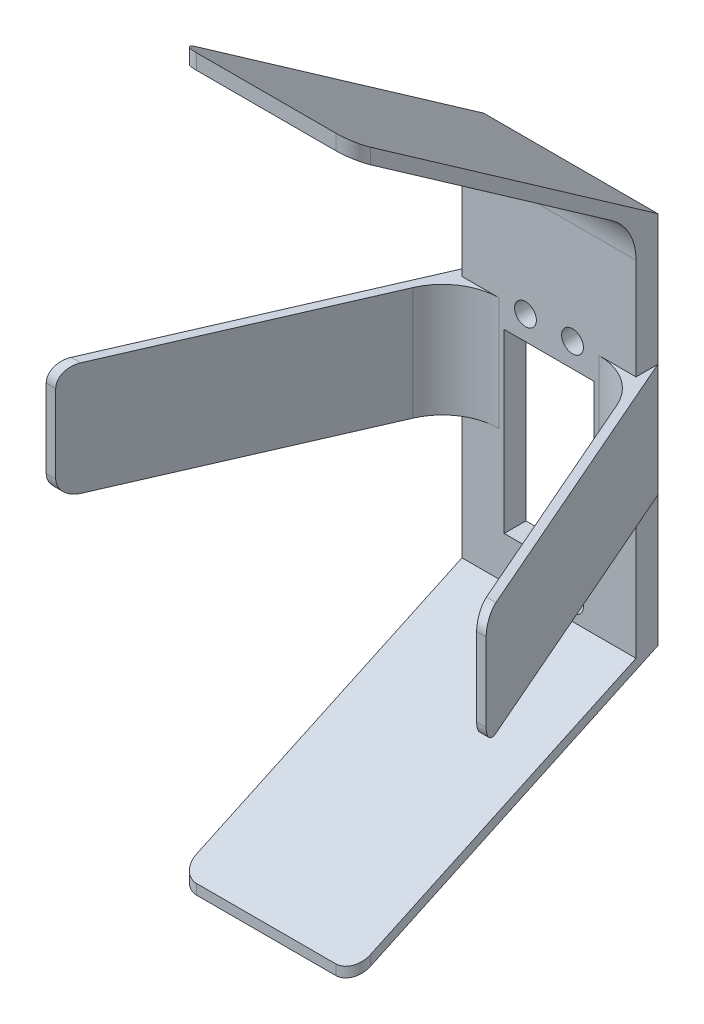
from build123d import *

# Parameters (mm, degrees)
ESQUISSE1_W             = 40
ESQUISSE1_H             = 60
ESQUISSE1_W_2           = 20.6
ESQUISSE1_H_2           = 40.6
BOSS_EXTRU_1_DEPTH      = 5
ESQUISSE2_W             = 40
ESQUISSE2_H             = 5
BOSS_EXTRU_2_DEPTH      = 26
BOSS_EXTRU_5_DEPTH      = 40
BOSS_EXTRU_6_DEPTH      = 26
CONG_1_R                = 13
CONG_2_R                = 4
ENL_V_MAT_EXTRU_1_REACH = 141.98
ESQUISSE6_R             = 2.5


with BuildPart() as part:
    # Esquisse1 → Boss.-Extru.1 (new body)
    with BuildSketch(Plane.XY):
        with Locations((-10, 0)):
            Rectangle(ESQUISSE1_W, ESQUISSE1_H)
        with Locations((-10, 0)):
            Rectangle(ESQUISSE1_W_2, ESQUISSE1_H_2, mode=Mode.SUBTRACT)
    extrude(amount=BOSS_EXTRU_1_DEPTH)

    # Esquisse2 → Boss.-Extru.2 (add)
    with BuildSketch(Plane(origin=(0, 30, 0), x_dir=(1, 0, 0), z_dir=(0, 1, 0))):
        with Locations((-10, -2.5)):
            Rectangle(ESQUISSE2_W, ESQUISSE2_H)
    extrude(amount=BOSS_EXTRU_2_DEPTH)

    # Esquisse3 → Boss.-Extru.5 (add)
    with BuildSketch(Plane(origin=(10, 0, 0), x_dir=(0, 0, -1), z_dir=(1, 0, 0))):
        Polygon((0, 56), (-70, 105.014527675), (-70, 101.513489984), (-5, 56), align=None)
        Polygon((-5, -30), (0, -30), (-70, -62.641536071), (-70, -60.30999778), align=None)
    extrude(amount=-BOSS_EXTRU_5_DEPTH)

    # Esquisse4 → Boss.-Extru.6 (add)
    with BuildSketch(Plane(origin=(0, 0, 0), x_dir=(1, 0, 0), z_dir=(0, 1, 0))):
        Polygon((-30, -5), (-58.368325731, -70), (-60.550504633, -70), (-30, 0), align=None)
        Polygon((10, 0), (40.550504633, -70), (38.368325731, -70), (10, -5), align=None)
    extrude(amount=BOSS_EXTRU_6_DEPTH)

    # Congé1
    cong_1_edges = [part.edges().sort_by_distance(p)[0] for p in [
        (-10, 56, 5),
        (10, 13, 5),
        (-30, 13, 5),
    ]]
    fillet(cong_1_edges, radius=CONG_1_R)

    # Congé2
    cong_2_edges = [part.edges().sort_by_distance(p)[0] for p in [
        (10, 103.264008829, 70),
        (-30, 103.264008829, 70),
        (10, -61.475766925, 70),
        (-30, -61.475766925, 70),
        (-59.459415182, 0, 70),
        (-59.459415182, 26, 70),
        (39.459415182, 0, 70),
        (39.459415182, 26, 70),
    ]]
    fillet(cong_2_edges, radius=CONG_2_R)

    # Esquisse6 → Enlèv. mat.-Extru.1 (cut, up to next)
    with BuildSketch(Plane(origin=(0, 0, 0), x_dir=(-1, 0, 0), z_dir=(0, 0, -1)), mode=Mode.PRIVATE) as enl_v_mat_extru_1_sk1:
        with Locations((4.6, -25.8)):
            Circle(ESQUISSE6_R)
    enl_v_mat_extru_1_tool1 = extrude(enl_v_mat_extru_1_sk1.sketch, amount=-ENL_V_MAT_EXTRU_1_REACH, mode=Mode.PRIVATE) & part.part
    # Esquisse6 → Enlèv. mat.-Extru.1 (cut, up to next)
    with BuildSketch(Plane(origin=(0, 0, 0), x_dir=(-1, 0, 0), z_dir=(0, 0, -1)), mode=Mode.PRIVATE) as enl_v_mat_extru_1_sk2:
        with Locations((15.4, -25.8)):
            Circle(ESQUISSE6_R)
    enl_v_mat_extru_1_tool2 = extrude(enl_v_mat_extru_1_sk2.sketch, amount=-ENL_V_MAT_EXTRU_1_REACH, mode=Mode.PRIVATE) & part.part
    # Esquisse6 → Enlèv. mat.-Extru.1 (cut, up to next)
    with BuildSketch(Plane(origin=(0, 0, 0), x_dir=(-1, 0, 0), z_dir=(0, 0, -1)), mode=Mode.PRIVATE) as enl_v_mat_extru_1_sk3:
        with Locations((4.6, 25.8)):
            Circle(ESQUISSE6_R)
    enl_v_mat_extru_1_tool3 = extrude(enl_v_mat_extru_1_sk3.sketch, amount=-ENL_V_MAT_EXTRU_1_REACH, mode=Mode.PRIVATE) & part.part
    # Esquisse6 → Enlèv. mat.-Extru.1 (cut, up to next)
    with BuildSketch(Plane(origin=(0, 0, 0), x_dir=(-1, 0, 0), z_dir=(0, 0, -1)), mode=Mode.PRIVATE) as enl_v_mat_extru_1_sk4:
        with Locations((15.4, 25.8)):
            Circle(ESQUISSE6_R)
    enl_v_mat_extru_1_tool4 = extrude(enl_v_mat_extru_1_sk4.sketch, amount=-ENL_V_MAT_EXTRU_1_REACH, mode=Mode.PRIVATE) & part.part
    add(enl_v_mat_extru_1_tool1.solids().sort_by_distance((-4.6, -25.8, 0))[0], mode=Mode.SUBTRACT)
    add(enl_v_mat_extru_1_tool2.solids().sort_by_distance((-15.4, -25.8, 0))[0], mode=Mode.SUBTRACT)
    add(enl_v_mat_extru_1_tool3.solids().sort_by_distance((-4.6, 25.8, 0))[0], mode=Mode.SUBTRACT)
    add(enl_v_mat_extru_1_tool4.solids().sort_by_distance((-15.4, 25.8, 0))[0], mode=Mode.SUBTRACT)


solid = part.part
